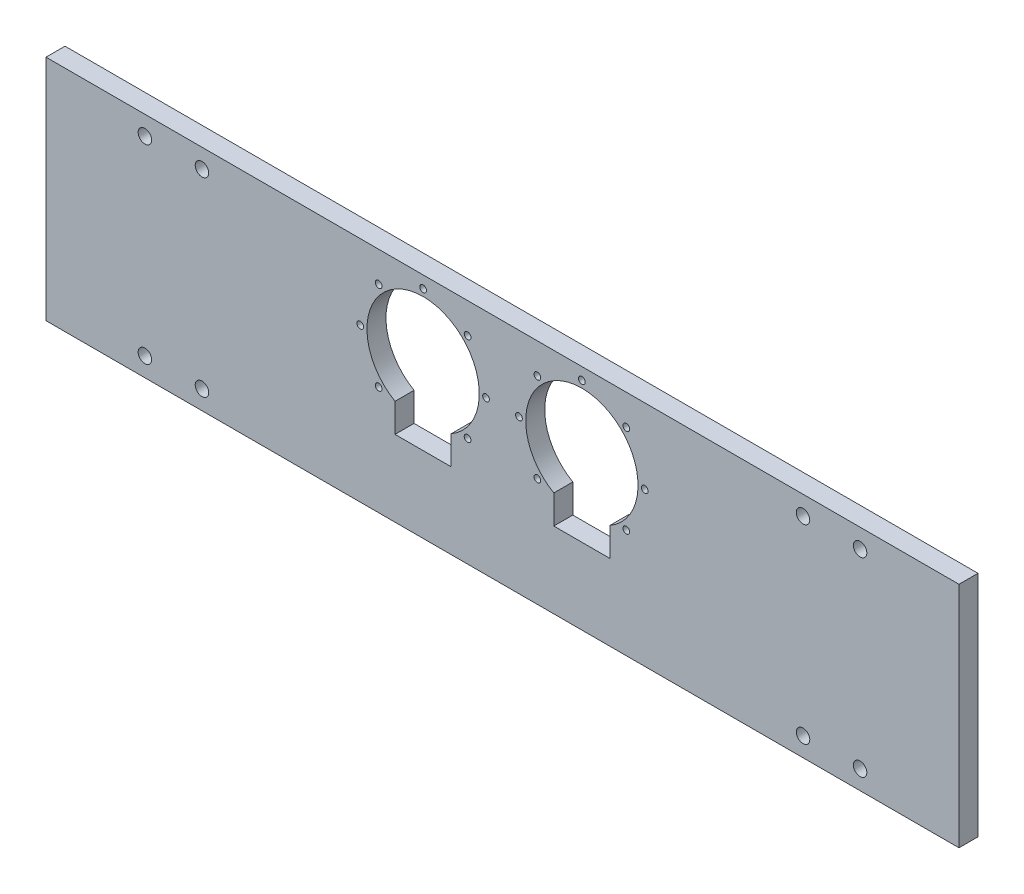
from build123d import *

# Parameters (mm, degrees)
SKETCH1_W           = 609.6
SKETCH1_H           = 152.4
SKETCH1_R           = 2.246
SKETCH1_R_2         = 4.5085
BOSS_EXTRUDE1_DEPTH = 12.7


with BuildPart() as part:
    # Sketch1 → Boss-Extrude1 (new body)
    with BuildSketch(Plane.XY):
        Rectangle(SKETCH1_W, SKETCH1_H)
        with Locations((53, 68.1999984)):
            Circle(SKETCH1_R, mode=Mode.SUBTRACT)
        with Locations((82.698486542, 55.898482492)):
            Circle(SKETCH1_R, mode=Mode.SUBTRACT)
        with Locations((95.00000245, 26.19999595)):
            Circle(SKETCH1_R, mode=Mode.SUBTRACT)
        with Locations((82.698486542, -3.498490592)):
            Circle(SKETCH1_R, mode=Mode.SUBTRACT)
        with Locations((23.301513458, -3.498490592)):
            Circle(SKETCH1_R, mode=Mode.SUBTRACT)
        with Locations((10.99999755, 26.19999595)):
            Circle(SKETCH1_R, mode=Mode.SUBTRACT)
        with Locations((23.301513458, 55.898482492)):
            Circle(SKETCH1_R, mode=Mode.SUBTRACT)
        with Locations((238.76, 63.5)):
            Circle(SKETCH1_R_2, mode=Mode.SUBTRACT)
        with Locations((200.66, 63.5)):
            Circle(SKETCH1_R_2, mode=Mode.SUBTRACT)
        with Locations(Location((238.76, -63.5, 0), (0, 0, 180))):
            Circle(SKETCH1_R_2, mode=Mode.SUBTRACT)
        with Locations(Location((200.66, -63.5, 0), (0, 0, 180))):
            Circle(SKETCH1_R_2, mode=Mode.SUBTRACT)
        with Locations(Location((-82.698486542, -3.498490592, 0), (0, 0, 180))):
            Circle(SKETCH1_R, mode=Mode.SUBTRACT)
        with Locations(Location((-95.00000245, 26.19999595, 0), (0, 0, 180))):
            Circle(SKETCH1_R, mode=Mode.SUBTRACT)
        with Locations(Location((-82.698486542, 55.898482492, 0), (0, 0, 180))):
            Circle(SKETCH1_R, mode=Mode.SUBTRACT)
        with Locations(Location((-53, 68.1999984, 0), (0, 0, 180))):
            Circle(SKETCH1_R, mode=Mode.SUBTRACT)
        with Locations(Location((-23.301513458, 55.898482492, 0), (0, 0, 180))):
            Circle(SKETCH1_R, mode=Mode.SUBTRACT)
        with Locations(Location((-10.99999755, 26.19999595, 0), (0, 0, 180))):
            Circle(SKETCH1_R, mode=Mode.SUBTRACT)
        with Locations(Location((-23.301513458, -3.498490592, 0), (0, 0, 180))):
            Circle(SKETCH1_R, mode=Mode.SUBTRACT)
        with Locations(Location((-238.76, 63.5, 0), (0, 0, 180))):
            Circle(SKETCH1_R_2, mode=Mode.SUBTRACT)
        with Locations(Location((-200.66, 63.5, 0), (0, 0, 180))):
            Circle(SKETCH1_R_2, mode=Mode.SUBTRACT)
        with Locations((-200.66, -63.5)):
            Circle(SKETCH1_R_2, mode=Mode.SUBTRACT)
        with Locations((-238.76, -63.5)):
            Circle(SKETCH1_R_2, mode=Mode.SUBTRACT)
        with BuildLine():
            Line((34.25, -6.275954242), (34.25, -25.4))
            Line((34.25, -25.4), (71.75, -25.4))
            Line((71.75, -25.4), (71.75, -6.275954242))
            ThreePointArc((71.75, -6.275954242), (53, 63.6999984), (34.25, -6.275954242))
        make_face(mode=Mode.SUBTRACT)
        with BuildLine():
            Line((-34.25, -6.275954242), (-34.25, -25.4))
            Line((-34.25, -25.4), (-71.75, -25.4))
            Line((-71.75, -25.4), (-71.75, -6.275954242))
            ThreePointArc((-71.75, -6.275954242), (-53, 63.6999984), (-34.25, -6.275954242))
        make_face(mode=Mode.SUBTRACT)
    extrude(amount=BOSS_EXTRUDE1_DEPTH)


solid = part.part
